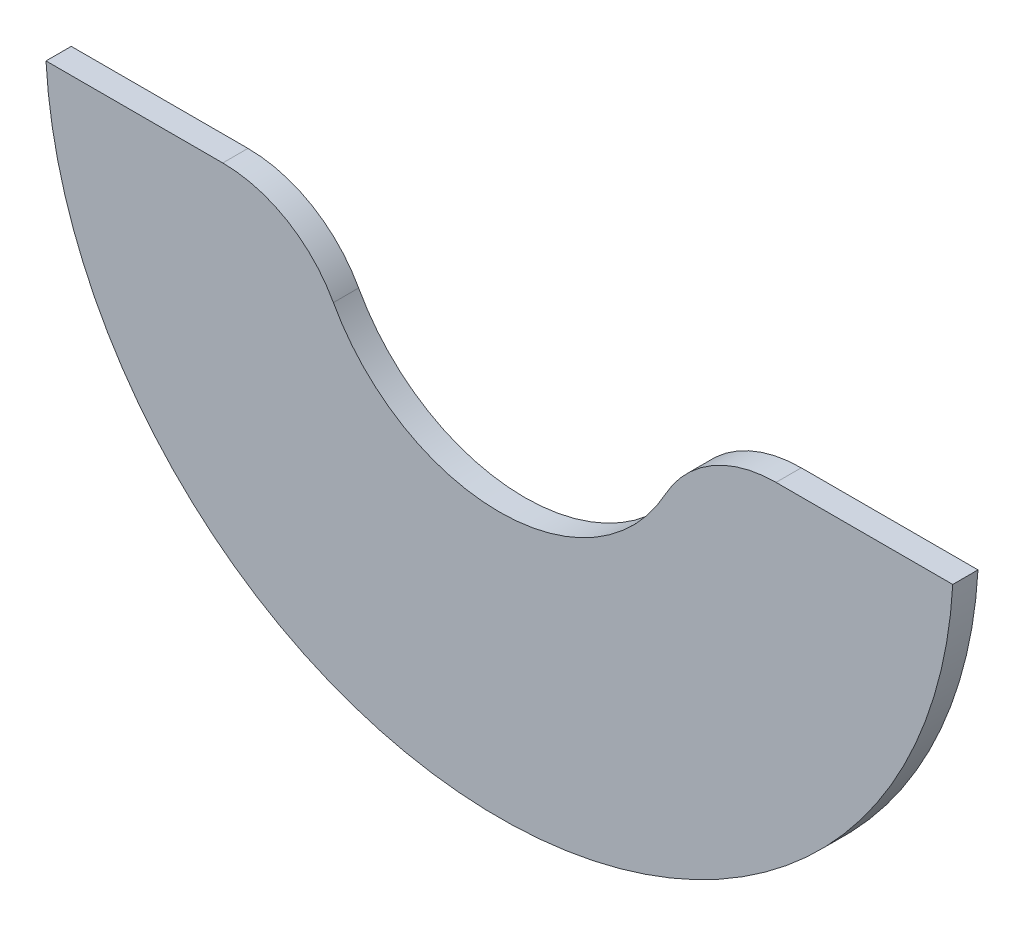
from build123d import *

# Parameters (mm, degrees)
BOSS_EXTRUDE1_DEPTH = 1
SKETCH2_R           = 7.5
CUT_EXTRUDE1_DEPTH  = 26.455844123
FILLET1_R           = 5


with BuildPart() as part:
    # Sketch1 → Boss-Extrude1 (new body)
    with BuildSketch(Plane.XY):
        with BuildLine():
            Line((-17.972200756, -1), (17.972200756, -1))
            ThreePointArc((17.972200756, -1), (0, -18), (-17.972200756, -1))
        make_face()
    extrude(amount=BOSS_EXTRUDE1_DEPTH)

    # Sketch2 → Cut-Extrude1 (cut, through all)
    with BuildSketch(Plane.XY.offset(1)):
        Circle(SKETCH2_R)
    extrude(amount=-CUT_EXTRUDE1_DEPTH, mode=Mode.SUBTRACT)

    # Fillet1
    fillet1_edges = [part.edges().sort_by_distance(p)[0] for p in [
        (7.433034374, -1, 0.5),
        (-7.433034374, -1, 0.5),
    ]]
    fillet(fillet1_edges, radius=FILLET1_R)


solid = part.part
